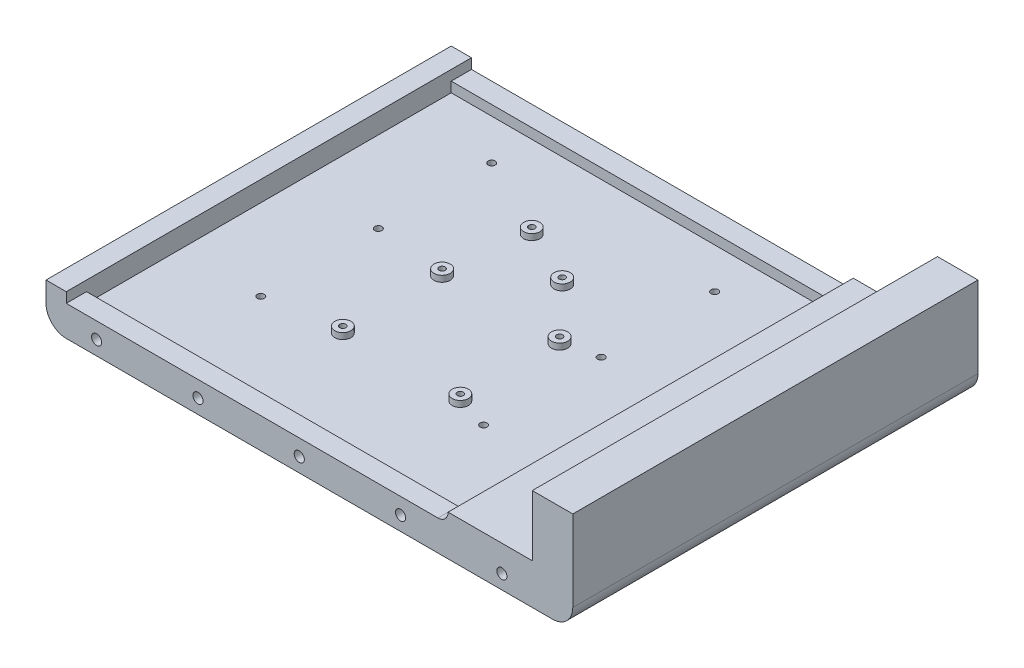
from build123d import *

# Parameters (mm, degrees)
EXTRUDE_1_DEPTH     = 200
CUT_EXTRUDE_1_REACH = 245.721
CUT_EXTRUDE_2_REACH = 243.091
SKETCH_4_R          = 1.75
SKETCH_4_R_2        = 1.5
SKETCH_6_W          = 183.452994616
SKETCH_6_H          = 180
CUT_EXTRUDE_4_DEPTH = 5
EXTRUDE_START       = 3
SKETCH_7_R          = 4
SKETCH_7_R_2        = 1.5
EXTRUDE_2_DEPTH     = 3
SKETCH_8_R          = 2.5
CUT_EXTRUDE_5_DEPTH = 15
SKETCH_9_R          = 3.5
CUT_EXTRUDE_6_DEPTH = 5


with BuildPart() as part:
    # 草图1 → 凸台-拉伸1 (new body)
    with BuildSketch(Plane.XY):
        with BuildLine():
            Line((-120, 0), (120, 0))
            ThreePointArc((120, 0), (127.071067812, 2.928932188), (130, 10))
            Line((130, 10), (130, 49.985304377))
            Line((130, 49.985304377), (130, 50))
            Line((130, 50), (110, 50))
            Line((110, 50), (110, 48.038475773))
            Line((110, 48.038475773), (110, 20))
            Line((110, 20), (-110, 20))
            Line((-110, 20), (-130, 20))
            Line((-130, 20), (-130, 10))
            ThreePointArc((-130, 10), (-127.071067812, 2.928932188), (-120, 0))
        make_face()
    extrude(amount=EXTRUDE_1_DEPTH)

    # 草图3 → 切除-拉伸1 (cut, up to next)
    with BuildSketch(Plane.XY.offset(200), mode=Mode.PRIVATE) as cut_extrude_1_sk1:
        with BuildLine():
            Line((-120, 20), (68.452994616, 20))
            ThreePointArc((68.452994616, 20), (66.988528522, 16.464466094), (63.452994616, 15))
            Line((63.452994616, 15), (-120, 15))
            Line((-120, 15), (-120, 20))
        make_face()
    cut_extrude_1_tool1 = extrude(cut_extrude_1_sk1.sketch, amount=-CUT_EXTRUDE_1_REACH, mode=Mode.PRIVATE) & part.part
    add(cut_extrude_1_tool1.solids().sort_by_distance((-26.306684, 17.507921, 200))[0], mode=Mode.SUBTRACT)

    # 草图4 → 切除-拉伸2 (cut, up to next)
    with BuildSketch(Plane(origin=(0, 15, 0), x_dir=(1, 0, 0), z_dir=(0, 1, 0)), mode=Mode.PRIVATE) as cut_extrude_2_sk1:
        with Locations(Location((30, -30, 0), (0, 0, 180))):
            Circle(SKETCH_4_R)
    cut_extrude_2_tool1 = extrude(cut_extrude_2_sk1.sketch, amount=-CUT_EXTRUDE_2_REACH, mode=Mode.PRIVATE) & part.part
    # 草图4 → 切除-拉伸2 (cut, up to next)
    with BuildSketch(Plane(origin=(0, 15, 0), x_dir=(1, 0, 0), z_dir=(0, 1, 0)), mode=Mode.PRIVATE) as cut_extrude_2_sk2:
        with Locations(Location((30, -86, 0), (0, 0, 180))):
            Circle(SKETCH_4_R)
    cut_extrude_2_tool2 = extrude(cut_extrude_2_sk2.sketch, amount=-CUT_EXTRUDE_2_REACH, mode=Mode.PRIVATE) & part.part
    # 草图4 → 切除-拉伸2 (cut, up to next)
    with BuildSketch(Plane(origin=(0, 15, 0), x_dir=(1, 0, 0), z_dir=(0, 1, 0)), mode=Mode.PRIVATE) as cut_extrude_2_sk3:
        with Locations(Location((30, -144, 0), (0, 0, 180))):
            Circle(SKETCH_4_R)
    cut_extrude_2_tool3 = extrude(cut_extrude_2_sk3.sketch, amount=-CUT_EXTRUDE_2_REACH, mode=Mode.PRIVATE) & part.part
    # 草图4 → 切除-拉伸2 (cut, up to next)
    with BuildSketch(Plane(origin=(0, 15, 0), x_dir=(1, 0, 0), z_dir=(0, 1, 0)), mode=Mode.PRIVATE) as cut_extrude_2_sk4:
        with Locations(Location((-80, -144, 0), (0, 0, 180))):
            Circle(SKETCH_4_R)
    cut_extrude_2_tool4 = extrude(cut_extrude_2_sk4.sketch, amount=-CUT_EXTRUDE_2_REACH, mode=Mode.PRIVATE) & part.part
    # 草图4 → 切除-拉伸2 (cut, up to next)
    with BuildSketch(Plane(origin=(0, 15, 0), x_dir=(1, 0, 0), z_dir=(0, 1, 0)), mode=Mode.PRIVATE) as cut_extrude_2_sk5:
        with Locations(Location((-80, -86, 0), (0, 0, 180))):
            Circle(SKETCH_4_R)
    cut_extrude_2_tool5 = extrude(cut_extrude_2_sk5.sketch, amount=-CUT_EXTRUDE_2_REACH, mode=Mode.PRIVATE) & part.part
    # 草图4 → 切除-拉伸2 (cut, up to next)
    with BuildSketch(Plane(origin=(0, 15, 0), x_dir=(1, 0, 0), z_dir=(0, 1, 0)), mode=Mode.PRIVATE) as cut_extrude_2_sk6:
        with Locations(Location((-80, -30, 0), (0, 0, 180))):
            Circle(SKETCH_4_R)
    cut_extrude_2_tool6 = extrude(cut_extrude_2_sk6.sketch, amount=-CUT_EXTRUDE_2_REACH, mode=Mode.PRIVATE) & part.part
    # 草图4 → 切除-拉伸2 (cut, up to next)
    with BuildSketch(Plane(origin=(0, 15, 0), x_dir=(1, 0, 0), z_dir=(0, 1, 0)), mode=Mode.PRIVATE) as cut_extrude_2_sk7:
        with Locations(Location((-10.76, -64.486, 0), (0, 0, 180))):
            Circle(SKETCH_4_R_2)
    cut_extrude_2_tool7 = extrude(cut_extrude_2_sk7.sketch, amount=-CUT_EXTRUDE_2_REACH, mode=Mode.PRIVATE) & part.part
    # 草图4 → 切除-拉伸2 (cut, up to next)
    with BuildSketch(Plane(origin=(0, 15, 0), x_dir=(1, 0, 0), z_dir=(0, 1, 0)), mode=Mode.PRIVATE) as cut_extrude_2_sk8:
        with Locations(Location((-39.76, -50.486, 0), (0, 0, 180))):
            Circle(SKETCH_4_R_2)
    cut_extrude_2_tool8 = extrude(cut_extrude_2_sk8.sketch, amount=-CUT_EXTRUDE_2_REACH, mode=Mode.PRIVATE) & part.part
    # 草图4 → 切除-拉伸2 (cut, up to next)
    with BuildSketch(Plane(origin=(0, 15, 0), x_dir=(1, 0, 0), z_dir=(0, 1, 0)), mode=Mode.PRIVATE) as cut_extrude_2_sk9:
        with Locations(Location((-44.089, -90.416, 0), (0, 0, 180))):
            Circle(SKETCH_4_R_2)
    cut_extrude_2_tool9 = extrude(cut_extrude_2_sk9.sketch, amount=-CUT_EXTRUDE_2_REACH, mode=Mode.PRIVATE) & part.part
    # 草图4 → 切除-拉伸2 (cut, up to next)
    with BuildSketch(Plane(origin=(0, 15, 0), x_dir=(1, 0, 0), z_dir=(0, 1, 0)), mode=Mode.PRIVATE) as cut_extrude_2_sk10:
        with Locations(Location((13.911, -90.416, 0), (0, 0, 180))):
            Circle(SKETCH_4_R_2)
    cut_extrude_2_tool10 = extrude(cut_extrude_2_sk10.sketch, amount=-CUT_EXTRUDE_2_REACH, mode=Mode.PRIVATE) & part.part
    # 草图4 → 切除-拉伸2 (cut, up to next)
    with BuildSketch(Plane(origin=(0, 15, 0), x_dir=(1, 0, 0), z_dir=(0, 1, 0)), mode=Mode.PRIVATE) as cut_extrude_2_sk11:
        with Locations(Location((13.911, -139.416, 0), (0, 0, 180))):
            Circle(SKETCH_4_R_2)
    cut_extrude_2_tool11 = extrude(cut_extrude_2_sk11.sketch, amount=-CUT_EXTRUDE_2_REACH, mode=Mode.PRIVATE) & part.part
    # 草图4 → 切除-拉伸2 (cut, up to next)
    with BuildSketch(Plane(origin=(0, 15, 0), x_dir=(1, 0, 0), z_dir=(0, 1, 0)), mode=Mode.PRIVATE) as cut_extrude_2_sk12:
        with Locations(Location((-44.089, -139.416, 0), (0, 0, 180))):
            Circle(SKETCH_4_R_2)
    cut_extrude_2_tool12 = extrude(cut_extrude_2_sk12.sketch, amount=-CUT_EXTRUDE_2_REACH, mode=Mode.PRIVATE) & part.part
    add(cut_extrude_2_tool1.solids().sort_by_distance((30, 15, 30))[0], mode=Mode.SUBTRACT)
    add(cut_extrude_2_tool2.solids().sort_by_distance((30, 15, 86))[0], mode=Mode.SUBTRACT)
    add(cut_extrude_2_tool3.solids().sort_by_distance((30, 15, 144))[0], mode=Mode.SUBTRACT)
    add(cut_extrude_2_tool4.solids().sort_by_distance((-80, 15, 144))[0], mode=Mode.SUBTRACT)
    add(cut_extrude_2_tool5.solids().sort_by_distance((-80, 15, 86))[0], mode=Mode.SUBTRACT)
    add(cut_extrude_2_tool6.solids().sort_by_distance((-80, 15, 30))[0], mode=Mode.SUBTRACT)
    add(cut_extrude_2_tool7.solids().sort_by_distance((-10.76, 15, 64.486))[0], mode=Mode.SUBTRACT)
    add(cut_extrude_2_tool8.solids().sort_by_distance((-39.76, 15, 50.486))[0], mode=Mode.SUBTRACT)
    add(cut_extrude_2_tool9.solids().sort_by_distance((-44.089, 15, 90.416))[0], mode=Mode.SUBTRACT)
    add(cut_extrude_2_tool10.solids().sort_by_distance((13.911, 15, 90.416))[0], mode=Mode.SUBTRACT)
    add(cut_extrude_2_tool11.solids().sort_by_distance((13.911, 15, 139.416))[0], mode=Mode.SUBTRACT)
    add(cut_extrude_2_tool12.solids().sort_by_distance((-44.089, 15, 139.416))[0], mode=Mode.SUBTRACT)

    # 草图6 → 切除-拉伸4 (cut)
    with BuildSketch(Plane(origin=(0, 15, 0), x_dir=(1, 0, 0), z_dir=(0, 1, 0))):
        with Locations((-28.273502692, -100)):
            Rectangle(SKETCH_6_W, SKETCH_6_H)
    extrude(amount=-CUT_EXTRUDE_4_DEPTH, mode=Mode.SUBTRACT)

    # 草图7 → 凸台-拉伸2 (add)
    # profile 1 of 6: a face of its own
    with BuildSketch(Plane(origin=(0, 10, 0), x_dir=(1, 0, 0), z_dir=(0, 1, 0)).offset(EXTRUDE_START)):
        with Locations(Location((-39.76, -50.486, 0), (0, 0, 180))):
            Circle(SKETCH_7_R)
        with Locations(Location((-39.76, -50.486, 0), (0, 0, 180))):
            Circle(SKETCH_7_R_2, mode=Mode.SUBTRACT)
    # profile 2 of 6: a face of its own
    with BuildSketch(Plane(origin=(0, 10, 0), x_dir=(1, 0, 0), z_dir=(0, 1, 0)).offset(EXTRUDE_START)):
        with Locations(Location((-10.76, -64.486, 0), (0, 0, 180))):
            Circle(SKETCH_7_R)
        with Locations(Location((-10.76, -64.486, 0), (0, 0, 180))):
            Circle(SKETCH_7_R_2, mode=Mode.SUBTRACT)
    # profile 3 of 6: a face of its own
    with BuildSketch(Plane(origin=(0, 10, 0), x_dir=(1, 0, 0), z_dir=(0, 1, 0)).offset(EXTRUDE_START)):
        with Locations(Location((13.911, -90.416, 0), (0, 0, 180))):
            Circle(SKETCH_7_R)
        with Locations(Location((13.911, -90.416, 0), (0, 0, 180))):
            Circle(SKETCH_7_R_2, mode=Mode.SUBTRACT)
    # profile 4 of 6: a face of its own
    with BuildSketch(Plane(origin=(0, 10, 0), x_dir=(1, 0, 0), z_dir=(0, 1, 0)).offset(EXTRUDE_START)):
        with Locations(Location((13.911, -139.416, 0), (0, 0, 180))):
            Circle(SKETCH_7_R)
        with Locations(Location((13.911, -139.416, 0), (0, 0, 180))):
            Circle(SKETCH_7_R_2, mode=Mode.SUBTRACT)
    # profile 5 of 6: a face of its own
    with BuildSketch(Plane(origin=(0, 10, 0), x_dir=(1, 0, 0), z_dir=(0, 1, 0)).offset(EXTRUDE_START)):
        with Locations(Location((-44.089, -139.416, 0), (0, 0, 180))):
            Circle(SKETCH_7_R)
        with Locations(Location((-44.089, -139.416, 0), (0, 0, 180))):
            Circle(SKETCH_7_R_2, mode=Mode.SUBTRACT)
    # profile 6 of 6: a face of its own
    with BuildSketch(Plane(origin=(0, 10, 0), x_dir=(1, 0, 0), z_dir=(0, 1, 0)).offset(EXTRUDE_START)):
        with Locations(Location((-44.089, -90.416, 0), (0, 0, 180))):
            Circle(SKETCH_7_R)
        with Locations(Location((-44.089, -90.416, 0), (0, 0, 180))):
            Circle(SKETCH_7_R_2, mode=Mode.SUBTRACT)
    extrude(amount=-EXTRUDE_2_DEPTH)

    # 草图8 → 切除-拉伸5 (cut)
    with BuildSketch(Plane(origin=(0, 0, 0), x_dir=(-1, 0, 0), z_dir=(0, 0, -1))):
        with Locations((105, 7)):
            Circle(SKETCH_8_R)
        with Locations((55, 7)):
            Circle(SKETCH_8_R)
        with Locations((5, 7)):
            Circle(SKETCH_8_R)
        with Locations((-45, 7)):
            Circle(SKETCH_8_R)
        with Locations((-95, 7)):
            Circle(SKETCH_8_R)
    cut_extrude_5 = extrude(amount=-CUT_EXTRUDE_5_DEPTH, mode=Mode.SUBTRACT)

    # 镜向1: 切除-拉伸5 across plane
    add(cut_extrude_5.mirror(Plane(origin=(0, 0, 100), x_dir=(1, 0, 0), z_dir=(0, 0, -1))), mode=Mode.SUBTRACT)

    # 草图9 → 切除-拉伸6 (cut)
    with BuildSketch(Plane.XZ):
        with Locations((-80, 144)):
            Circle(SKETCH_9_R)
        with Locations((30, 144)):
            Circle(SKETCH_9_R)
        with Locations((30, 86)):
            Circle(SKETCH_9_R)
        with Locations((30, 30)):
            Circle(SKETCH_9_R)
        with Locations((-80, 30)):
            Circle(SKETCH_9_R)
        with Locations((-80, 86)):
            Circle(SKETCH_9_R)
    extrude(amount=-CUT_EXTRUDE_6_DEPTH, mode=Mode.SUBTRACT)


solid = part.part
